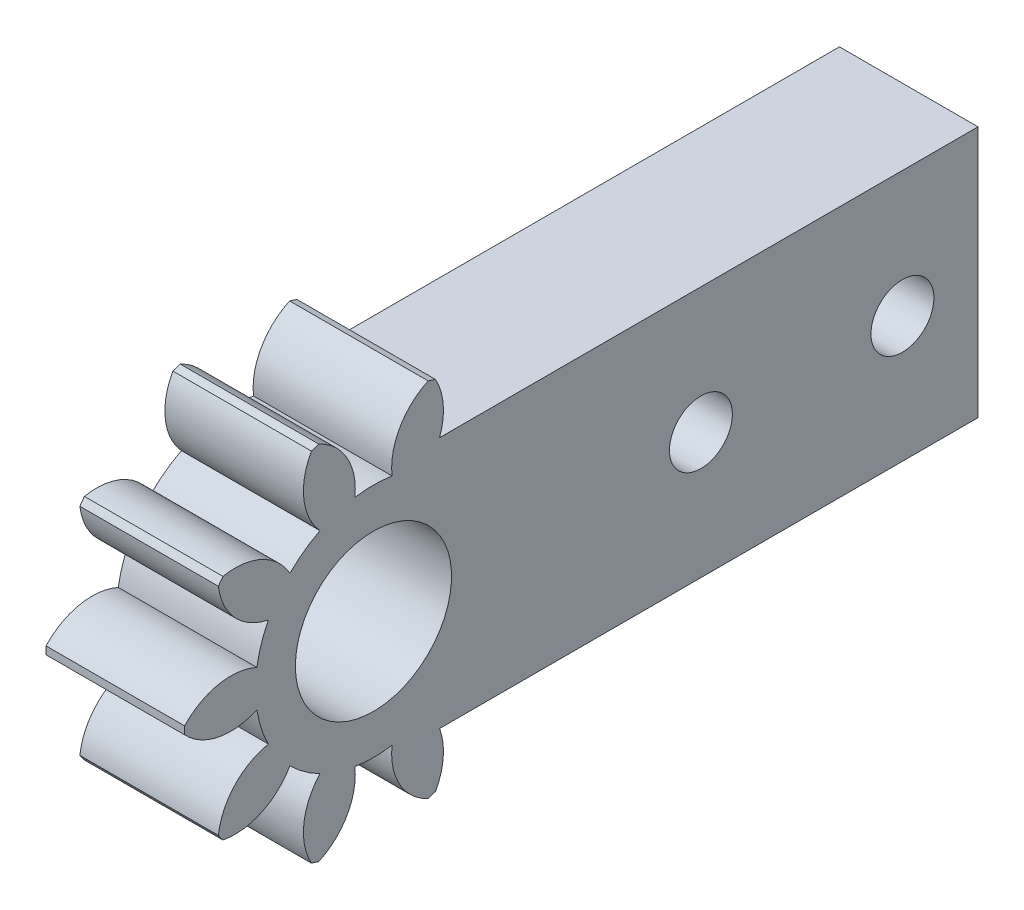
from build123d import *

# Parameters (mm, degrees)
BASPROSKE_W     = 5.5
BASPROSKE_H     = 7.5
TOOTHCUT_DEPTH  = 12.947803145
TEETHCUTS_COUNT = 10
TEETHCUTS_ANGLE = 324
BORSKE_R        = 3.1
BORE_DEPTH      = 50.0000508
EXTRUDE_START   = -5.5
SKETCH_1_R      = 1.25
EXTRUDE_1_DEPTH = 5.5


with BuildPart() as part:
    # BasProSke → Base-Revolve (revolve)
    with BuildSketch(Plane(origin=(0, 0, 0), x_dir=(1, 0, 0), z_dir=(0, 1, 0)), mode=Mode.PRIVATE) as base_revolve_sk:
        with Locations((2.75, 3.75)):
            Rectangle(BASPROSKE_W, BASPROSKE_H)
    revolve(base_revolve_sk.sketch.rotate(Axis((-10, 0, 0), (1, 0, 0)), 180), axis=Axis((-10, 0, 0), (1, 0, 0)))

    # TooCutSke → ToothCut (cut, through all)
    with BuildSketch(Plane(origin=(0, 0, 0), x_dir=(0, 0, -1), z_dir=(1, 0, 0))):
        with BuildLine():
            ThreePointArc((0.737676151, 4.628079099), (0, 4.6865), (-0.737676151, 4.628079099))
            ThreePointArc((-0.737676151, 4.628079099), (-1.051542781, 6.151798382), (-2.205760267, 7.194877817))
            ThreePointArc((-2.205760267, 7.194877817), (0, 7.5254), (2.205760267, 7.194877817))
            ThreePointArc((2.205760267, 7.194877817), (1.051542781, 6.151798382), (0.737676151, 4.628079099))
        make_face()
    toothcut = extrude(amount=TOOTHCUT_DEPTH, mode=Mode.SUBTRACT)

    # TeethCuts: ToothCut ×10 about axis
    teethcuts_axis = Axis((-10, 0, 0), (1, 0, 0))
    for i in range(1, TEETHCUTS_COUNT):
        add(toothcut.rotate(teethcuts_axis, i * TEETHCUTS_ANGLE / (TEETHCUTS_COUNT - 1)), mode=Mode.SUBTRACT)

    # BorSke → Bore (cut, symmetric)
    with BuildSketch(Plane(origin=(0, 0, 0), x_dir=(0, 0, -1), z_dir=(1, 0, 0))):
        with Locations(Location((0, 0, 0), (0, 0, 180))):
            Circle(BORSKE_R)
    extrude(amount=BORE_DEPTH, both=True, mode=Mode.SUBTRACT)

    # ｽｹｯﾁ1 → ﾎﾞｽ - 押し出し1 (add)
    with BuildSketch(Plane(origin=(5.5, 0, 0), x_dir=(0, 0, -1), z_dir=(1, 0, 0)).offset(EXTRUDE_START)):
        with BuildLine():
            Line((2.625065975, -5), (24, -5))
            Line((24, -5), (24, 5))
            Line((24, 5), (2.625065975, 5))
            ThreePointArc((2.625065975, 5), (2.414263067, 4.564514712), (2.123524099, 4.177789805))
            ThreePointArc((2.123524099, 4.177789805), (2.754655585, 3.791458144), (3.317109183, 3.31059948))
            ThreePointArc((3.317109183, 3.31059948), (4.449153618, 4.350870864), (5.975877892, 4.53198449))
            ThreePointArc((5.975877892, 4.53198449), (6.067627458, 4.408389392), (6.156821206, 4.282937385))
            ThreePointArc((6.156821206, 4.282937385), (5.512788165, 2.886903504), (4.173610318, 2.131726803))
            ThreePointArc((4.173610318, 2.131726803), (4.457126364, 1.448208144), (4.629519252, 0.728583383))
            ThreePointArc((4.629519252, 0.728583383), (6.156818616, 0.904781587), (7.498420418, 0.153919576))
            ThreePointArc((7.498420418, 0.153919576), (7.5, 0), (7.498420418, -0.153919576))
            ThreePointArc((7.498420418, -0.153919576), (6.156818616, -0.904781587), (4.629519252, -0.728583383))
            ThreePointArc((4.629519252, -0.728583383), (4.457126364, -1.448208144), (4.173610318, -2.131726803))
            ThreePointArc((4.173610318, -2.131726803), (5.512788165, -2.886903504), (6.156821206, -4.282937385))
            ThreePointArc((6.156821206, -4.282937385), (6.067627458, -4.408389392), (5.975877892, -4.53198449))
            ThreePointArc((5.975877892, -4.53198449), (4.449153618, -4.350870864), (3.317109183, -3.31059948))
            ThreePointArc((3.317109183, -3.31059948), (2.754655585, -3.791458144), (2.123524099, -4.177789805))
            ThreePointArc((2.123524099, -4.177789805), (2.414263067, -4.564514712), (2.625065975, -5))
        make_face()
        with Locations((13, 0)):
            Circle(SKETCH_1_R, mode=Mode.SUBTRACT)
        with Locations((21, 0)):
            Circle(SKETCH_1_R, mode=Mode.SUBTRACT)
    extrude(amount=EXTRUDE_1_DEPTH)


solid = part.part
